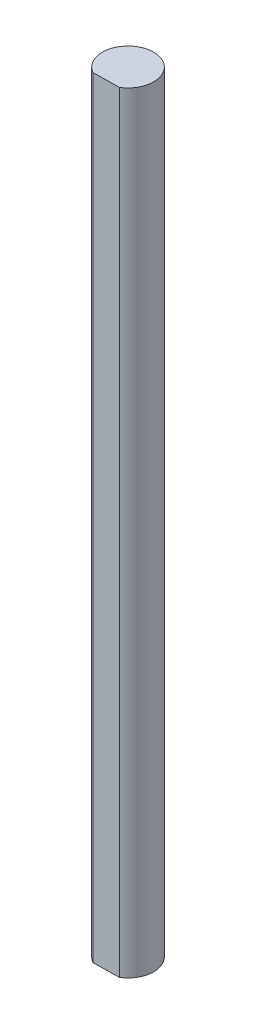
from build123d import *

# Parameters (mm, degrees)
ESQUISSE1_R             = 2
BOSS_EXTRU_1_DEPTH      = 60
ENL_V_MAT_EXTRU_1_DEPTH = 61.066629671


with BuildPart() as part:
    # Esquisse1 → Boss.-Extru.1 (new body)
    with BuildSketch(Plane(origin=(0, 0, 0), x_dir=(1, 0, 0), z_dir=(0, 1, 0))):
        with Locations(Location((0, 0, 0), (0, 0, 270))):
            Circle(ESQUISSE1_R)
    extrude(amount=BOSS_EXTRU_1_DEPTH)

    # Esquisse3 → Enlèv. mat.-Extru.1 (cut, through all)
    with BuildSketch(Plane(origin=(0, 60, 0), x_dir=(1, 0, 0), z_dir=(0, 1, 0))):
        with BuildLine():
            Line((1.036356451, -1.710545324), (-0.9792116, -1.743887795))
            ThreePointArc((-0.9792116, -1.743887795), (0.033080411, -1.999726403), (1.036356451, -1.710545324))
        make_face()
    extrude(amount=-ENL_V_MAT_EXTRU_1_DEPTH, mode=Mode.SUBTRACT)


solid = part.part
